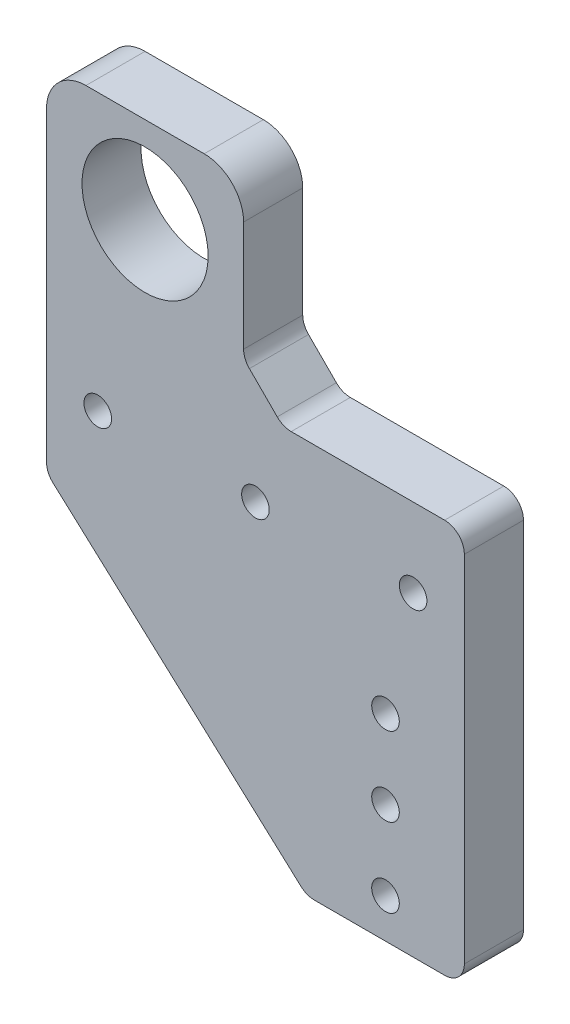
from build123d import *

# Parameters (mm, degrees)
BOSS_EXTRU_1_DEPTH           = 15
ENL_V_MAT_EXTRU_1_DEPTH      = 147.495733726
ENL_V_MAT_EXTRU_1_DEPTH_BACK = 147.495733726
ESQUISSE2_R                  = 3.5
ESQUISSE3_W                  = 50
ESQUISSE3_H                  = 50
BOSS_EXTRU_2_DEPTH           = 15
CHANFREIN1_SIZE              = 10
ENL_V_MAT_EXTRU_2_DEPTH      = 185.285105204
ENL_V_MAT_EXTRU_2_DEPTH_BACK = 185.285105204
ESQUISSE4_R                  = 16
CONG_2_R                     = 5
CONG_3_R                     = 10


with BuildPart() as part:
    # Esquisse1 → Boss.-Extru.1 (new body)
    with BuildSketch(Plane.XY):
        Polygon((0, 0), (0, 100), (-106, 100), (-106, 60), (-40, 0), align=None)
    extrude(amount=BOSS_EXTRU_1_DEPTH)

    # Esquisse2 → Enlèv. mat.-Extru.1 (cut, two sides: drawn at the far end of the back side and taken through both)
    with BuildSketch(Plane.XY.offset(15).offset(-ENL_V_MAT_EXTRU_1_DEPTH_BACK)):
        with Locations((-20, 10)):
            Circle(ESQUISSE2_R)
        with Locations((-20, 30)):
            Circle(ESQUISSE2_R)
        with Locations((-20, 50)):
            Circle(ESQUISSE2_R)
        with Locations((-53, 80)):
            Circle(ESQUISSE2_R)
        with Locations((-93, 80)):
            Circle(ESQUISSE2_R)
        with Locations((-13, 80)):
            Circle(ESQUISSE2_R)
    extrude(amount=ENL_V_MAT_EXTRU_1_DEPTH + ENL_V_MAT_EXTRU_1_DEPTH_BACK, mode=Mode.SUBTRACT)

    # Esquisse3 → Boss.-Extru.2 (add)
    with BuildSketch(Plane.XY.offset(15)):
        with Locations((-81, 125)):
            Rectangle(ESQUISSE3_W, ESQUISSE3_H)
    extrude(amount=-BOSS_EXTRU_2_DEPTH)

    # Chanfrein1
    chanfrein1_edges = [part.edges().sort_by_distance(p)[0] for p in [
        (-56, 100, 7.5),
    ]]
    chamfer(chanfrein1_edges, length=CHANFREIN1_SIZE)

    # Esquisse4 → Enlèv. mat.-Extru.2 (cut, two sides: drawn at the far end of the back side and taken through both)
    with BuildSketch(Plane.XY.offset(15).offset(-ENL_V_MAT_EXTRU_2_DEPTH_BACK)):
        with Locations((-81, 128)):
            Circle(ESQUISSE4_R)
    extrude(amount=ENL_V_MAT_EXTRU_2_DEPTH + ENL_V_MAT_EXTRU_2_DEPTH_BACK, mode=Mode.SUBTRACT)

    # Congé2
    cong_2_edges = [part.edges().sort_by_distance(p)[0] for p in [
        (-46, 100, 7.5),
        (-56, 110, 7.5),
        (-40, 0, 7.5),
        (-106, 60, 7.5),
        (0, 100, 7.5),
        (0, 0, 7.5),
    ]]
    fillet(cong_2_edges, radius=CONG_2_R)

    # Congé3
    cong_3_edges = [part.edges().sort_by_distance(p)[0] for p in [
        (-106, 150, 7.5),
        (-56, 150, 7.5),
    ]]
    fillet(cong_3_edges, radius=CONG_3_R)


solid = part.part
